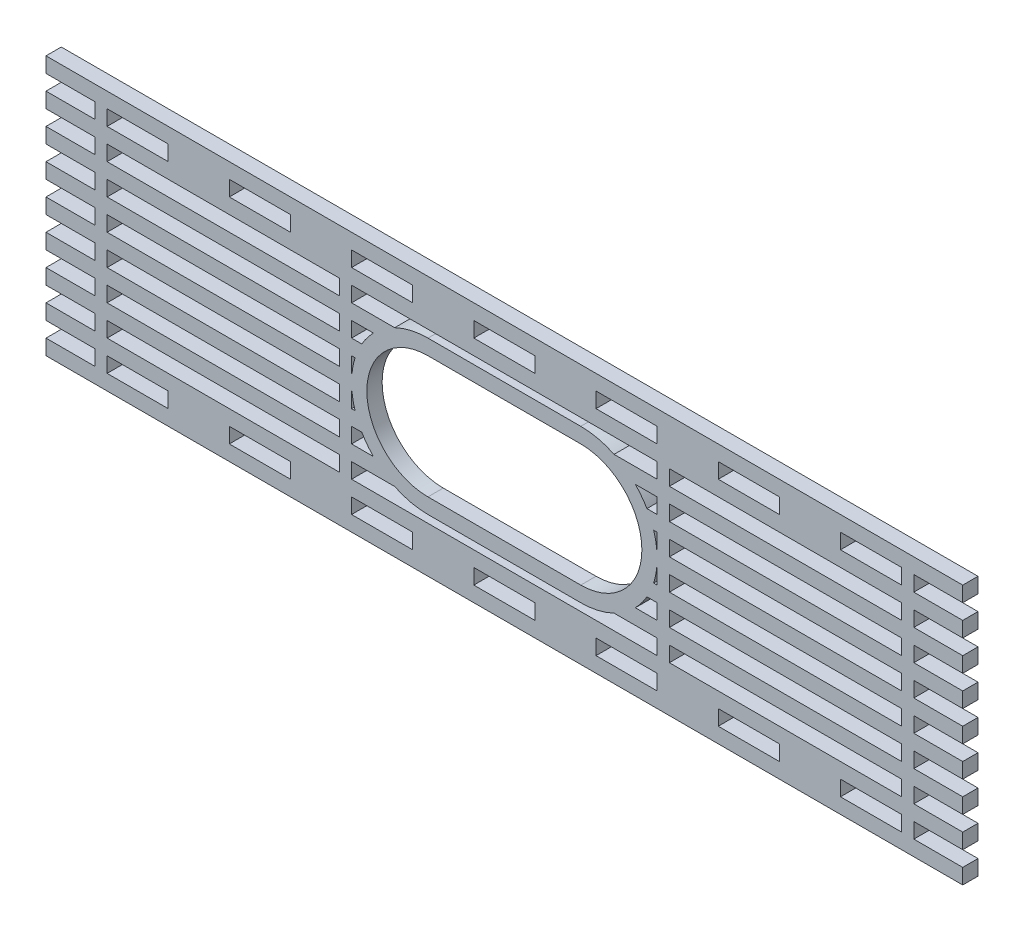
from build123d import *

# Parameters (mm, degrees)
SKETCH1_W           = 10
SKETCH1_H           = 2.5
SKETCH1_W_2         = 38
BOSS_EXTRUDE1_DEPTH = 1.25


with BuildPart() as part:
    # Sketch1 → Boss-Extrude1 (new, symmetric)
    with BuildSketch(Plane.XY):
        Polygon((75, 18.75), (75, 21.25), (-75, 21.25), (-75, 18.75), (-67, 18.75), (-67, 16.25), (-75, 16.25), (-75, 13.75), (-67, 13.75), (-67, 11.25), (-75, 11.25), (-75, 8.75), (-67, 8.75), (-67, 6.25), (-75, 6.25), (-75, 3.75), (-67, 3.75), (-67, 1.25), (-75, 1.25), (-75, -1.25), (-67, -1.25), (-67, -3.75), (-75, -3.75), (-75, -6.25), (-67, -6.25), (-67, -8.75), (-75, -8.75), (-75, -11.25), (-67, -11.25), (-67, -13.75), (-75, -13.75), (-75, -16.25), (-67, -16.25), (-67, -18.75), (-75, -18.75), (-75, -21.25), (75, -21.25), (75, -18.75), (67, -18.75), (67, -16.25), (75, -16.25), (75, -13.75), (67, -13.75), (67, -11.25), (75, -11.25), (75, -8.75), (67, -8.75), (67, -6.25), (75, -6.25), (75, -3.75), (67, -3.75), (67, -1.25), (75, -1.25), (75, 1.25), (67, 1.25), (67, 3.75), (75, 3.75), (75, 6.25), (67, 6.25), (67, 8.75), (75, 8.75), (75, 11.25), (67, 11.25), (67, 13.75), (75, 13.75), (75, 16.25), (67, 16.25), (67, 18.75), align=None)
        with Locations((-60, -17.5)):
            Rectangle(SKETCH1_W, SKETCH1_H, mode=Mode.SUBTRACT)
        with Locations((-40, -17.5)):
            Rectangle(SKETCH1_W, SKETCH1_H, mode=Mode.SUBTRACT)
        with Locations((-46, -12.5)):
            Rectangle(SKETCH1_W_2, SKETCH1_H, mode=Mode.SUBTRACT)
        with Locations((-20, -17.5)):
            Rectangle(SKETCH1_W, SKETCH1_H, mode=Mode.SUBTRACT)
        with Locations((-46, -7.5)):
            Rectangle(SKETCH1_W_2, SKETCH1_H, mode=Mode.SUBTRACT)
        with Locations((-46, -2.5)):
            Rectangle(SKETCH1_W_2, SKETCH1_H, mode=Mode.SUBTRACT)
        with Locations((0, -17.5)):
            Rectangle(SKETCH1_W, SKETCH1_H, mode=Mode.SUBTRACT)
        with Locations((20, -17.5)):
            Rectangle(SKETCH1_W, SKETCH1_H, mode=Mode.SUBTRACT)
        with Locations((40, -17.5)):
            Rectangle(SKETCH1_W, SKETCH1_H, mode=Mode.SUBTRACT)
        with Locations((60, -17.5)):
            Rectangle(SKETCH1_W, SKETCH1_H, mode=Mode.SUBTRACT)
        with Locations((46, -12.5)):
            Rectangle(SKETCH1_W_2, SKETCH1_H, mode=Mode.SUBTRACT)
        with BuildLine():
            Line((-25, 8.75), (-21.426785536, 8.75))
            ThreePointArc((-21.426785536, 8.75), (-22.454842744, 7.559835048), (-23.325317547, 6.25))
            Line((-23.325317547, 6.25), (-25, 6.25))
            Line((-25, 6.25), (-25, 8.75))
        make_face(mode=Mode.SUBTRACT)
        with BuildLine():
            Line((-25, 3.75), (-24.424240018, 3.75))
            ThreePointArc((-24.424240018, 3.75), (-24.744761384, 2.513129256), (-24.937342964, 1.25))
            Line((-24.937342964, 1.25), (-25, 1.25))
            Line((-25, 1.25), (-25, 3.75))
        make_face(mode=Mode.SUBTRACT)
        with BuildLine():
            Line((-25, -1.25), (-24.937342964, -1.25))
            ThreePointArc((-24.937342964, -1.25), (-24.744761384, -2.513129256), (-24.424240018, -3.75))
            Line((-24.424240018, -3.75), (-25, -3.75))
            Line((-25, -3.75), (-25, -1.25))
        make_face(mode=Mode.SUBTRACT)
        with BuildLine():
            Line((-25, -6.25), (-23.325317547, -6.25))
            ThreePointArc((-23.325317547, -6.25), (-22.454842744, -7.559835048), (-21.426785536, -8.75))
            Line((-21.426785536, -8.75), (-25, -8.75))
            Line((-25, -8.75), (-25, -6.25))
        make_face(mode=Mode.SUBTRACT)
        with BuildLine():
            Line((-25, -11.25), (-17.948623679, -11.25))
            ThreePointArc((-17.948623679, -11.25), (-15.295084972, -12.183492931), (-12.5, -12.5))
            Line((-12.5, -12.5), (12.5, -12.5))
            ThreePointArc((12.5, -12.5), (15.295084972, -12.183492931), (17.948623679, -11.25))
            Line((17.948623679, -11.25), (25, -11.25))
            Line((25, -11.25), (25, -13.75))
            Line((25, -13.75), (-25, -13.75))
            Line((-25, -13.75), (-25, -11.25))
        make_face(mode=Mode.SUBTRACT)
        with BuildLine():
            Line((25, -8.75), (21.426785536, -8.75))
            ThreePointArc((21.426785536, -8.75), (22.454842744, -7.559835048), (23.325317547, -6.25))
            Line((23.325317547, -6.25), (25, -6.25))
            Line((25, -6.25), (25, -8.75))
        make_face(mode=Mode.SUBTRACT)
        with BuildLine():
            Line((25, -3.75), (24.424240018, -3.75))
            ThreePointArc((24.424240018, -3.75), (24.744761384, -2.513129256), (24.937342964, -1.25))
            Line((24.937342964, -1.25), (25, -1.25))
            Line((25, -1.25), (25, -3.75))
        make_face(mode=Mode.SUBTRACT)
        with BuildLine():
            Line((25, 1.25), (24.937342964, 1.25))
            ThreePointArc((24.937342964, 1.25), (24.744761384, 2.513129256), (24.424240018, 3.75))
            Line((24.424240018, 3.75), (25, 3.75))
            Line((25, 3.75), (25, 1.25))
        make_face(mode=Mode.SUBTRACT)
        with BuildLine():
            Line((25, 6.25), (23.325317547, 6.25))
            ThreePointArc((23.325317547, 6.25), (22.454842744, 7.559835048), (21.426785536, 8.75))
            Line((21.426785536, 8.75), (25, 8.75))
            Line((25, 8.75), (25, 6.25))
        make_face(mode=Mode.SUBTRACT)
        with BuildLine():
            Line((25, 11.25), (17.948623679, 11.25))
            ThreePointArc((17.948623679, 11.25), (15.295084972, 12.183492931), (12.5, 12.5))
            Line((12.5, 12.5), (-12.5, 12.5))
            ThreePointArc((-12.5, 12.5), (-15.295084972, 12.183492931), (-17.948623679, 11.25))
            Line((-17.948623679, 11.25), (-25, 11.25))
            Line((-25, 11.25), (-25, 13.75))
            Line((-25, 13.75), (25, 13.75))
            Line((25, 13.75), (25, 11.25))
        make_face(mode=Mode.SUBTRACT)
        with Locations((46, -7.5)):
            Rectangle(SKETCH1_W_2, SKETCH1_H, mode=Mode.SUBTRACT)
        with Locations((46, -2.5)):
            Rectangle(SKETCH1_W_2, SKETCH1_H, mode=Mode.SUBTRACT)
        with Locations((-46, 2.5)):
            Rectangle(SKETCH1_W_2, SKETCH1_H, mode=Mode.SUBTRACT)
        with Locations((-46, 7.5)):
            Rectangle(SKETCH1_W_2, SKETCH1_H, mode=Mode.SUBTRACT)
        with Locations((-46, 12.5)):
            Rectangle(SKETCH1_W_2, SKETCH1_H, mode=Mode.SUBTRACT)
        with Locations((-60, 17.5)):
            Rectangle(SKETCH1_W, SKETCH1_H, mode=Mode.SUBTRACT)
        with Locations((-40, 17.5)):
            Rectangle(SKETCH1_W, SKETCH1_H, mode=Mode.SUBTRACT)
        with Locations((-20, 17.5)):
            Rectangle(SKETCH1_W, SKETCH1_H, mode=Mode.SUBTRACT)
        with Locations((46, 2.5)):
            Rectangle(SKETCH1_W_2, SKETCH1_H, mode=Mode.SUBTRACT)
        with Locations((46, 7.5)):
            Rectangle(SKETCH1_W_2, SKETCH1_H, mode=Mode.SUBTRACT)
        with Locations((0, 17.5)):
            Rectangle(SKETCH1_W, SKETCH1_H, mode=Mode.SUBTRACT)
        with Locations((20, 17.5)):
            Rectangle(SKETCH1_W, SKETCH1_H, mode=Mode.SUBTRACT)
        with Locations((46, 12.5)):
            Rectangle(SKETCH1_W_2, SKETCH1_H, mode=Mode.SUBTRACT)
        with Locations((40, 17.5)):
            Rectangle(SKETCH1_W, SKETCH1_H, mode=Mode.SUBTRACT)
        with Locations((60, 17.5)):
            Rectangle(SKETCH1_W, SKETCH1_H, mode=Mode.SUBTRACT)
        with BuildLine():
            Line((12.5, -10), (-12.5, -10))
            ThreePointArc((-12.5, -10), (-22.5, 0), (-12.5, 10))
            Line((-12.5, 10), (12.5, 10))
            ThreePointArc((12.5, 10), (22.5, 0), (12.5, -10))
        make_face(mode=Mode.SUBTRACT)
    extrude(amount=BOSS_EXTRUDE1_DEPTH, both=True)


solid = part.part
